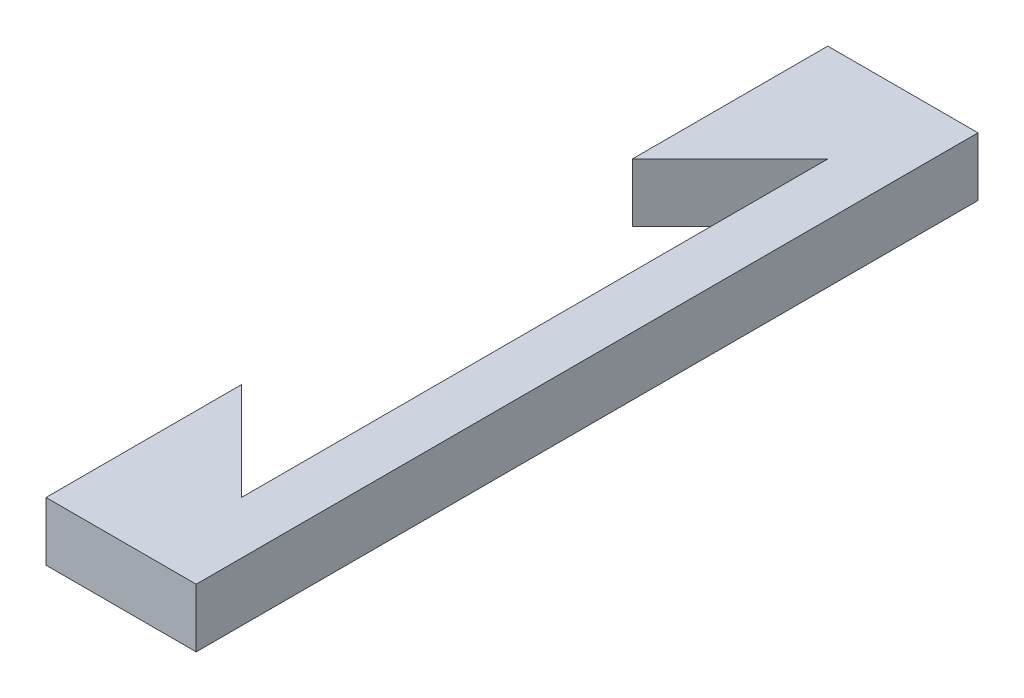
from build123d import *

# Parameters (mm, degrees)
CROQUIS1_R                 = 11
CROQUIS1_R_2               = 2
CROQUIS1_R_3               = 1.937672591
CROQUIS1_W                 = 30
CROQUIS1_H                 = 3
SALIENTE_EXTRUIR1_DEPTH    = 3
CROQUIS2_R                 = 13
CROQUIS2_R_2               = 11
SALIENTE_EXTRUIR2_DEPTH    = 4
CROQUIS3_R                 = 13
CROQUIS3_R_2               = 9
SALIENTE_EXTRUIR3_DEPTH    = 2
CHAFL_N1_SIZE              = 2
CHAFL_N2_SIZE              = 10
CORTAR_EXTRUIR1_DEPTH      = 10
CORTAR_EXTRUIR1_DEPTH_BACK = 10
CROQUIS4_W                 = 138.754626828
CROQUIS4_H                 = 77.213714618


with BuildPart() as part:
    # Croquis1 → Saliente-Extruir1 (new body)
    with BuildSketch(Plane(origin=(0, 0, 0), x_dir=(1, 0, 0), z_dir=(0, 1, 0))):
        Polygon((-67.5, 10), (-62.5, 15), (-62.5, -15), (-67.5, -10), (-67.5, -20), (67.5, -20), (67.5, 20), (-67.5, 20), align=None)
        with Locations((46.713951104, 0)):
            Circle(CROQUIS1_R, mode=Mode.SUBTRACT)
        with Locations((-52.5, 0)):
            Circle(CROQUIS1_R_2, mode=Mode.SUBTRACT)
        with Locations((27.185770037, 0)):
            Circle(CROQUIS1_R_3, mode=Mode.SUBTRACT)
        with Locations((12.185770037, 0)):
            Circle(CROQUIS1_R_2, mode=Mode.SUBTRACT)
        with Locations((-27.5, 11)):
            Rectangle(CROQUIS1_W, CROQUIS1_H, mode=Mode.SUBTRACT)
        with Locations((-27.5, -11)):
            Rectangle(CROQUIS1_W, CROQUIS1_H, mode=Mode.SUBTRACT)
    extrude(amount=SALIENTE_EXTRUIR1_DEPTH)

    # Croquis2 → Saliente-Extruir2 (add)
    with BuildSketch(Plane(origin=(0, 3, 0), x_dir=(1, 0, 0), z_dir=(0, 1, 0))):
        with Locations((46.713951104, 0)):
            Circle(CROQUIS2_R)
        with Locations((46.713951104, 0)):
            Circle(CROQUIS2_R_2, mode=Mode.SUBTRACT)
    extrude(amount=SALIENTE_EXTRUIR2_DEPTH)

    # Croquis3 → Saliente-Extruir3 (add)
    with BuildSketch(Plane(origin=(0, 7, 0), x_dir=(1, 0, 0), z_dir=(0, 1, 0))):
        with Locations((46.713951104, 0)):
            Circle(CROQUIS3_R)
        with Locations((46.713951104, 0)):
            Circle(CROQUIS3_R_2, mode=Mode.SUBTRACT)
    extrude(amount=SALIENTE_EXTRUIR3_DEPTH)

    # Chaflán1
    chafl_n1_edges = [part.edges().sort_by_distance(p)[0] for p in [
        (33.713951104, 9, 0),
    ]]
    chamfer(chafl_n1_edges, length=CHAFL_N1_SIZE)

    # Chaflán2
    chafl_n2_edges = [part.edges().sort_by_distance(p)[0] for p in [
        (67.5, 1.5, -20),
        (67.5, 1.5, 20),
    ]]
    chamfer(chafl_n2_edges, length=CHAFL_N2_SIZE)

    # Croquis4 → Cortar-Extruir1 (cut, two sides: drawn at the far end of the back side and taken through both)
    with BuildSketch(Plane(origin=(0, 3, 0), x_dir=(1, 0, 0), z_dir=(0, 1, 0)).offset(-CORTAR_EXTRUIR1_DEPTH_BACK)):
        with Locations((9.561847341, -1.869233315)):
            Rectangle(CROQUIS4_W, CROQUIS4_H)
    extrude(amount=CORTAR_EXTRUIR1_DEPTH + CORTAR_EXTRUIR1_DEPTH_BACK, mode=Mode.SUBTRACT)


solid = part.part
